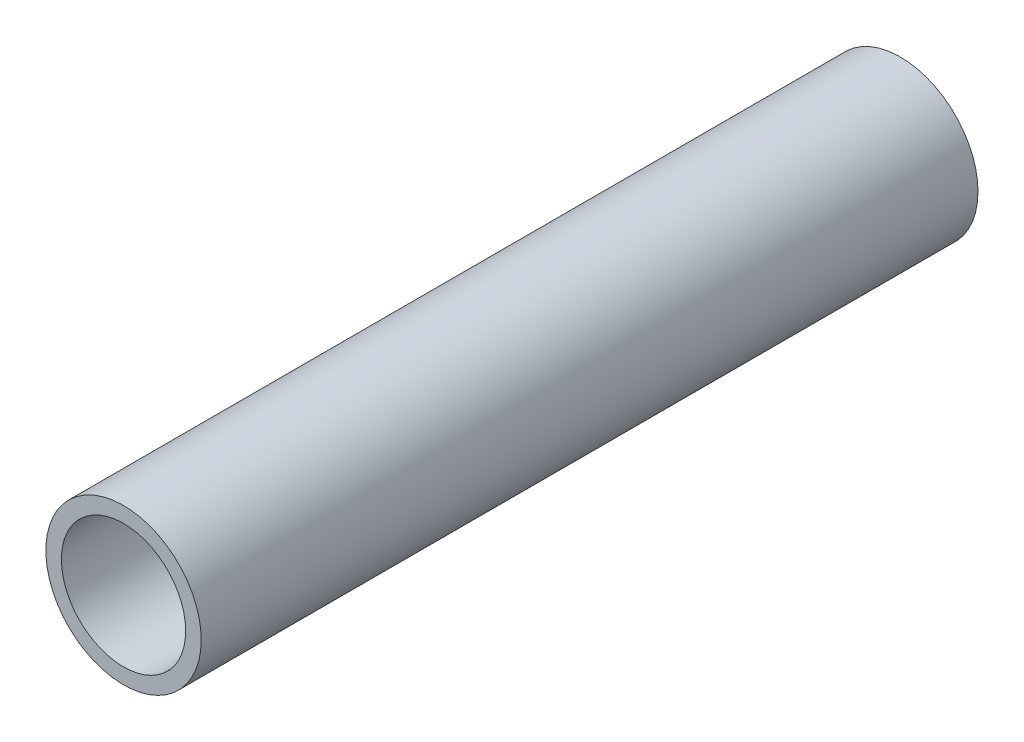
from build123d import *

# Parameters (mm, degrees)
SZKIC1_R                    = 15
SZKIC1_R_2                  = 12
DODANIE_WYCI_GNI_CIE1_DEPTH = 150


with BuildPart() as part:
    # Szkic1 → Dodanie-wyciągnięcie1 (new body)
    with BuildSketch(Plane.XY):
        Circle(SZKIC1_R)
        Circle(SZKIC1_R_2, mode=Mode.SUBTRACT)
    extrude(amount=DODANIE_WYCI_GNI_CIE1_DEPTH)


solid = part.part
